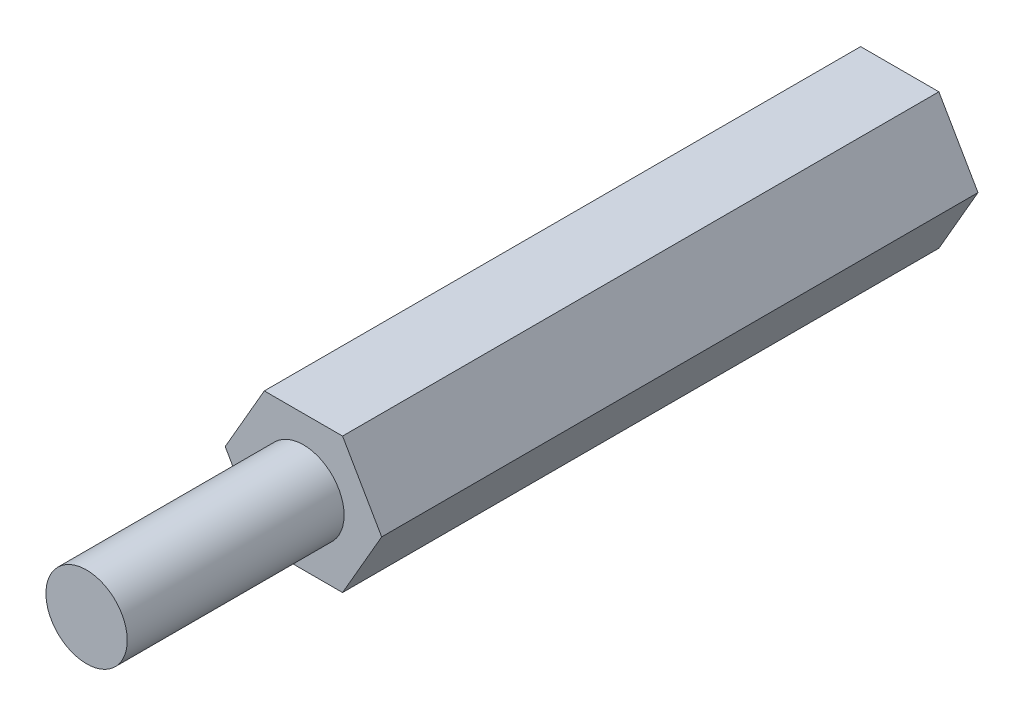
from build123d import *

# Parameters (mm, degrees)
EXTRUDE_1_DEPTH = 22
SKETCH_2_R      = 1.5
EXTRUDE_2_DEPTH = 8
M3X0_5_1_D      = 2.5
M3X0_5_1_DEPTH  = 11
M3X0_5_1_TIP    = 0.751075774


with BuildPart() as part:
    # 草图1 → 拉伸1 (new body)
    with BuildSketch(Plane.XY):
        Polygon((1.443375673, -2.5), (2.886751346, 0), (1.443375673, 2.5), (-1.443375673, 2.5), (-2.886751346, 0), (-1.443375673, -2.5), align=None)
    extrude(amount=EXTRUDE_1_DEPTH)

    # 草图2 → 拉伸2 (add)
    with BuildSketch(Plane.XY.offset(22)):
        Circle(SKETCH_2_R)
    extrude(amount=EXTRUDE_2_DEPTH)

    # M3x0.5 螺纹孔1
    with Locations(Plane(origin=(0, 0, 0), x_dir=(-1, 0, 0), z_dir=(0, 0, -1))):
        with Locations((0, 0)):
            Hole(M3X0_5_1_D / 2, depth=M3X0_5_1_DEPTH)
            with Locations((0, 0, -(M3X0_5_1_DEPTH + M3X0_5_1_TIP / 2))):  # 118° drill point
                Cone(0, M3X0_5_1_D / 2, M3X0_5_1_TIP, mode=Mode.SUBTRACT)


solid = part.part
